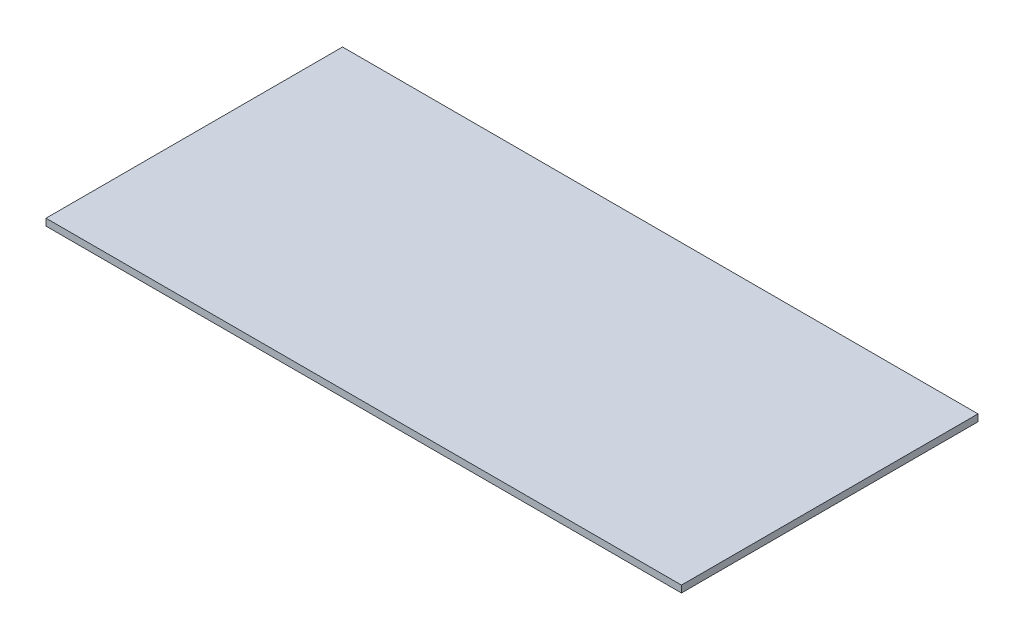
from build123d import *

# Parameters (mm, degrees)
SKETCH1_W           = 1200
SKETCH1_H           = 560
BOSS_EXTRUDE1_DEPTH = 13


with BuildPart() as part:
    # Sketch1 → Boss-Extrude1 (new body)
    with BuildSketch(Plane(origin=(0, 0, 0), x_dir=(1, 0, 0), z_dir=(0, 1, 0))):
        Rectangle(SKETCH1_W, SKETCH1_H)
    extrude(amount=BOSS_EXTRUDE1_DEPTH)


solid = part.part
